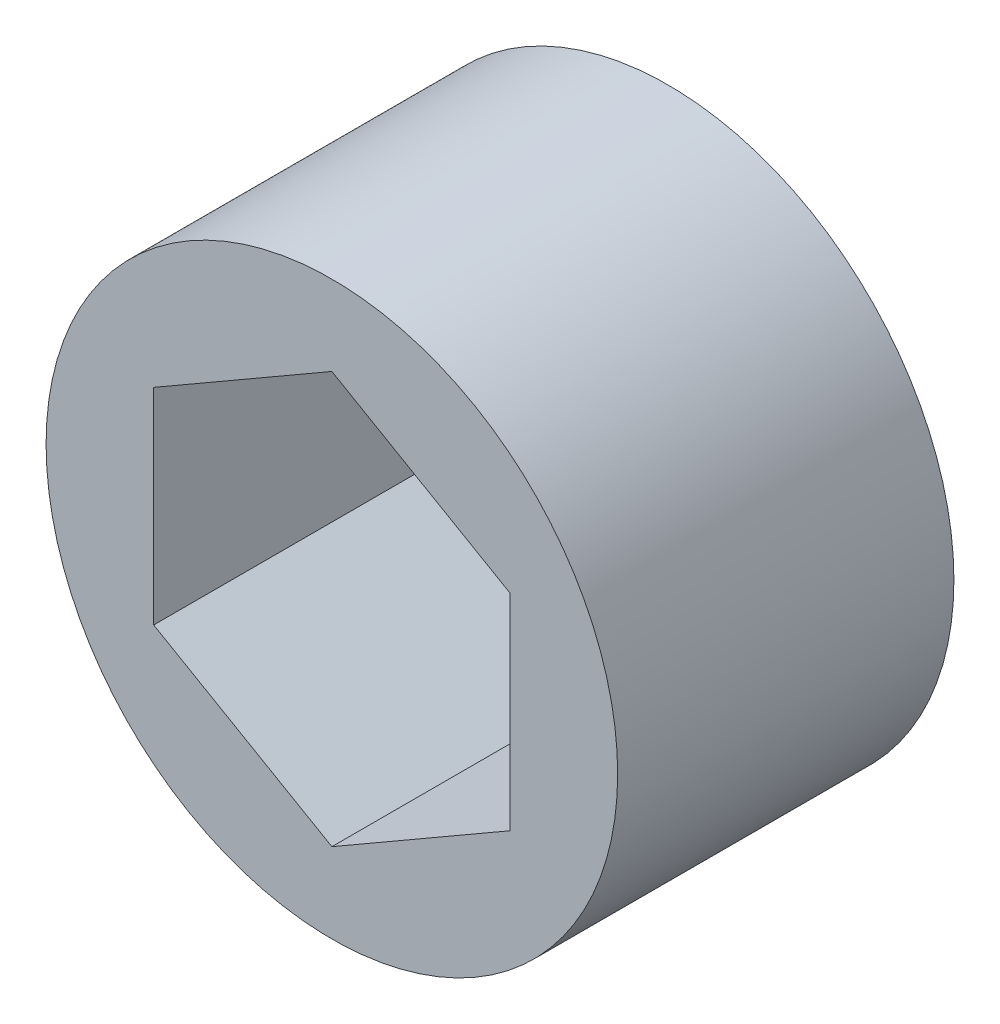
from build123d import *

# Parameters (mm, degrees)
SKETCH1_R           = 10.795
BOSS_EXTRUDE1_DEPTH = 12.7


with BuildPart() as part:
    # Sketch1 → Boss-Extrude1 (new body)
    with BuildSketch(Plane.XY):
        Circle(SKETCH1_R)
        Polygon((0, 7.772289324), (-6.731, 3.886144662), (-6.731, -3.886144662), (0, -7.772289324), (6.731, -3.886144662), (6.731, 3.886144662), align=None, mode=Mode.SUBTRACT)
    extrude(amount=BOSS_EXTRUDE1_DEPTH)


solid = part.part
